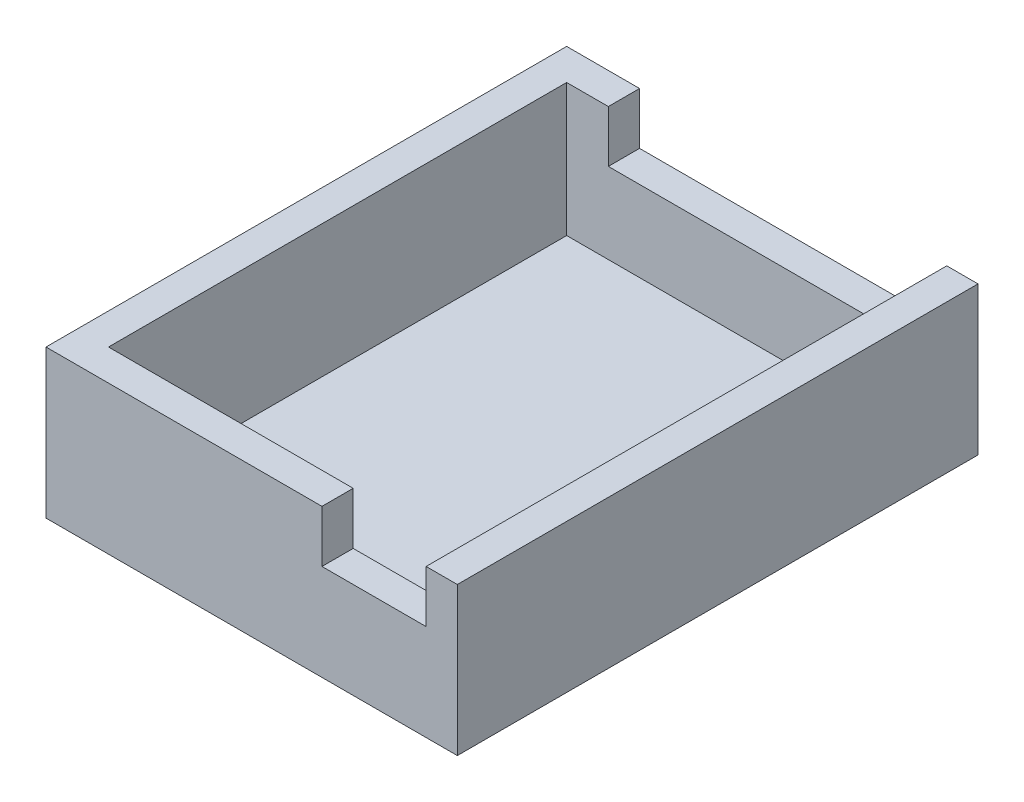
from build123d import *

# Parameters (mm, degrees)
SKETCH1_W           = 39.5
SKETCH1_H           = 50
BOSS_EXTRUDE1_DEPTH = 1.5
SKETCH3_W           = 39.5
SKETCH3_H           = 50
SKETCH3_W_2         = 33.5
SKETCH3_H_2         = 44
BOSS_EXTRUDE2_DEPTH = 12.73
SKETCH6_W           = 10
SKETCH6_H           = 5
CUT_EXTRUDE2_DEPTH  = 11.2
SKETCH7_W           = 29.5
SKETCH7_H           = 4.98
CUT_EXTRUDE3_DEPTH  = 3.3


with BuildPart() as part:
    # Sketch1 → Boss-Extrude1 (new body)
    with BuildSketch(Plane(origin=(0, 0, 0), x_dir=(1, 0, 0), z_dir=(0, 1, 0))):
        with Locations((19.75, 25)):
            Rectangle(SKETCH1_W, SKETCH1_H)
    extrude(amount=BOSS_EXTRUDE1_DEPTH)

    # Sketch3 → Boss-Extrude2 (add)
    with BuildSketch(Plane(origin=(0, 1.5, 0), x_dir=(1, 0, 0), z_dir=(0, 1, 0))):
        with Locations((19.75, 25)):
            Rectangle(SKETCH3_W, SKETCH3_H)
        with Locations((19.75, 25)):
            Rectangle(SKETCH3_W_2, SKETCH3_H_2, mode=Mode.SUBTRACT)
    extrude(amount=BOSS_EXTRUDE2_DEPTH)

    # Sketch6 → Cut-Extrude2 (cut)
    with BuildSketch(Plane.XY):
        with Locations((31.5, 11.73)):
            Rectangle(SKETCH6_W, SKETCH6_H)
    extrude(amount=-CUT_EXTRUDE2_DEPTH, mode=Mode.SUBTRACT)

    # Sketch7 → Cut-Extrude3 (cut)
    with BuildSketch(Plane(origin=(0, 0, -50), x_dir=(-1, 0, 0), z_dir=(0, 0, -1))):
        with Locations((-21.75, 11.74)):
            Rectangle(SKETCH7_W, SKETCH7_H)
    extrude(amount=-CUT_EXTRUDE3_DEPTH, mode=Mode.SUBTRACT)


solid = part.part
